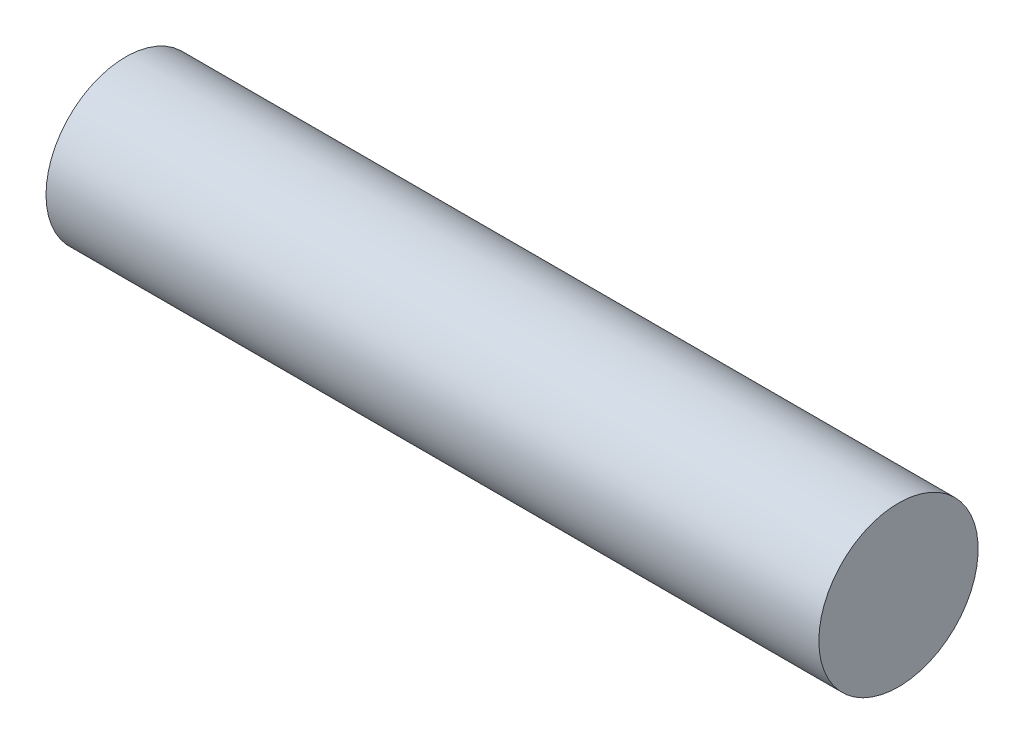
from build123d import *

# Parameters (mm, degrees)
LEG_CARTRIDGE_SKETCH_W = 130
LEG_CARTRIDGE_SKETCH_H = 13.4


with BuildPart() as part:
    # Leg_Cartridge Sketch → Leg_Cartridge (revolve)
    with BuildSketch(Plane.XY):
        with Locations((1175, 6.7)):
            Rectangle(LEG_CARTRIDGE_SKETCH_W, LEG_CARTRIDGE_SKETCH_H)
    revolve(axis=Axis((-3000, 0, 0), (1, 0, 0)))


solid = part.part
